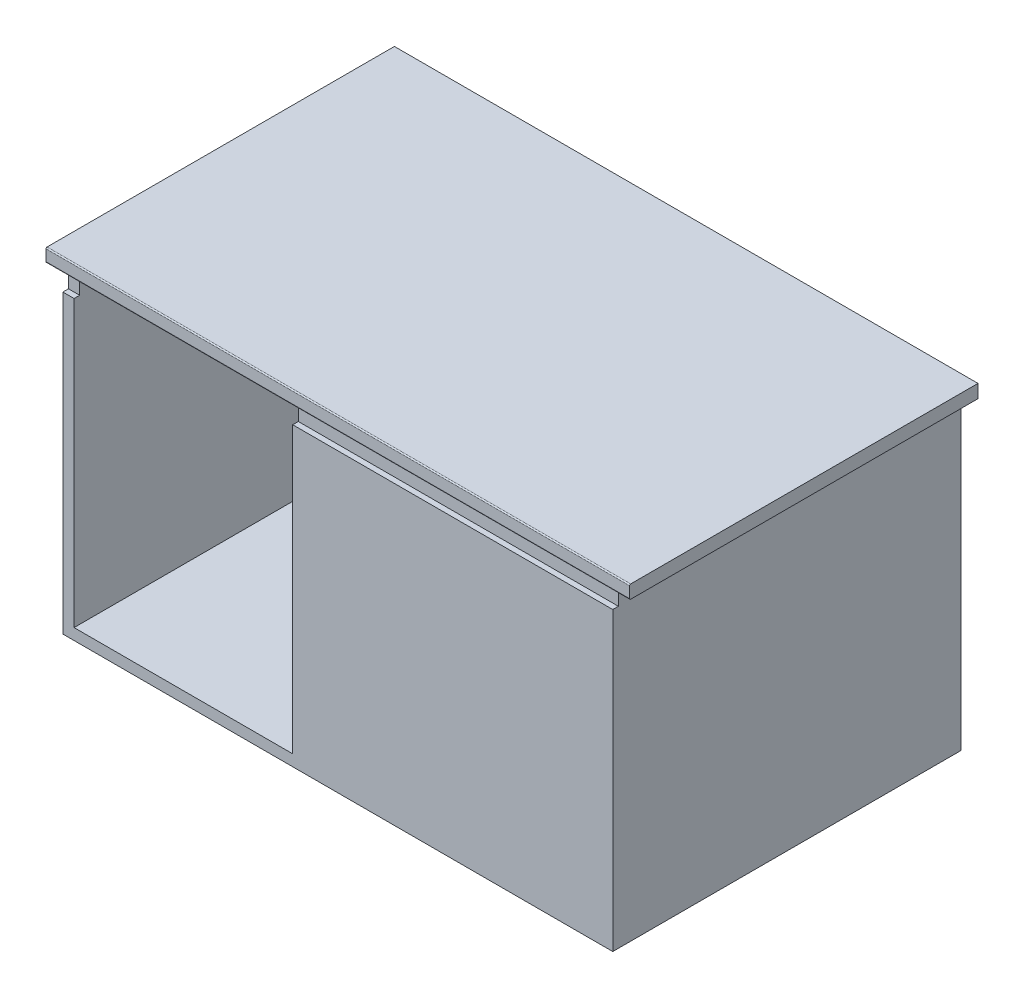
from build123d import *

# Parameters (mm, degrees)
SKETCH1_W           = 1320
SKETCH1_H           = 788
BOSS_EXTRUDE1_DEPTH = 738
SKETCH5_W           = 1320
SKETCH5_H           = 38
CUT_EXTRUDE1_DEPTH  = 12.7
FILLET2_R           = 2.54
CUT_EXTRUDE2_REACH  = 1067.589
SKETCH6_W           = 38.1
SKETCH6_H           = 788
SKETCH8_W           = 494.5
SKETCH8_H           = 682.6
CUT_EXTRUDE3_DEPTH  = 762.6


with BuildPart() as part:
    # Sketch1 → Boss-Extrude1 (new body)
    with BuildSketch(Plane(origin=(0, 0, 0), x_dir=(1, 0, 0), z_dir=(0, 1, 0))):
        Rectangle(SKETCH1_W, SKETCH1_H)
    extrude(amount=BOSS_EXTRUDE1_DEPTH)

    # Sketch5 → Cut-Extrude1 (cut)
    with BuildSketch(Plane.XY.offset(394)):
        with Locations((0, 689)):
            Rectangle(SKETCH5_W, SKETCH5_H)
    extrude(amount=-CUT_EXTRUDE1_DEPTH, mode=Mode.SUBTRACT)

    # Fillet2
    fillet2_edges = [part.edges().sort_by_distance(p)[0] for p in [
        (0, 708, 394),
        (0, 738, 394),
    ]]
    fillet(fillet2_edges, radius=FILLET2_R)

    # Cut-Extrude2: up to this face of the body (flat: up to its plane)
    cut_extrude2_end = Plane(part.part.faces().sort_by_distance((0, 708, 386.38))[0])
    # Sketch6 → Cut-Extrude2 (cut, up to the picked face)
    with BuildSketch(Plane.XZ, mode=Mode.PRIVATE) as cut_extrude2_sk1:
        with Locations((640.95, 0)):
            Rectangle(SKETCH6_W, SKETCH6_H)
    cut_extrude2_tool1 = split(extrude(cut_extrude2_sk1.sketch, amount=-CUT_EXTRUDE2_REACH, mode=Mode.PRIVATE), bisect_by=cut_extrude2_end, keep=Keep.BOTH, mode=Mode.PRIVATE)
    # Sketch6 → Cut-Extrude2 (cut, up to the picked face)
    with BuildSketch(Plane.XZ, mode=Mode.PRIVATE) as cut_extrude2_sk2:
        with Locations((-640.95, 0)):
            Rectangle(SKETCH6_W, SKETCH6_H)
    cut_extrude2_tool2 = split(extrude(cut_extrude2_sk2.sketch, amount=-CUT_EXTRUDE2_REACH, mode=Mode.PRIVATE), bisect_by=cut_extrude2_end, keep=Keep.BOTH, mode=Mode.PRIVATE)
    add(cut_extrude2_tool1.solids().sort_by(Axis((640.95, 0, 0), (0, 1, 0)))[0], mode=Mode.SUBTRACT)
    add(cut_extrude2_tool2.solids().sort_by(Axis((-640.95, 0, 0), (0, 1, 0)))[0], mode=Mode.SUBTRACT)

    # Sketch8 → Cut-Extrude3 (cut)
    with BuildSketch(Plane.XY.offset(394)):
        with Locations((-349.25, 366.7)):
            Rectangle(SKETCH8_W, SKETCH8_H)
    extrude(amount=-CUT_EXTRUDE3_DEPTH, mode=Mode.SUBTRACT)


solid = part.part
